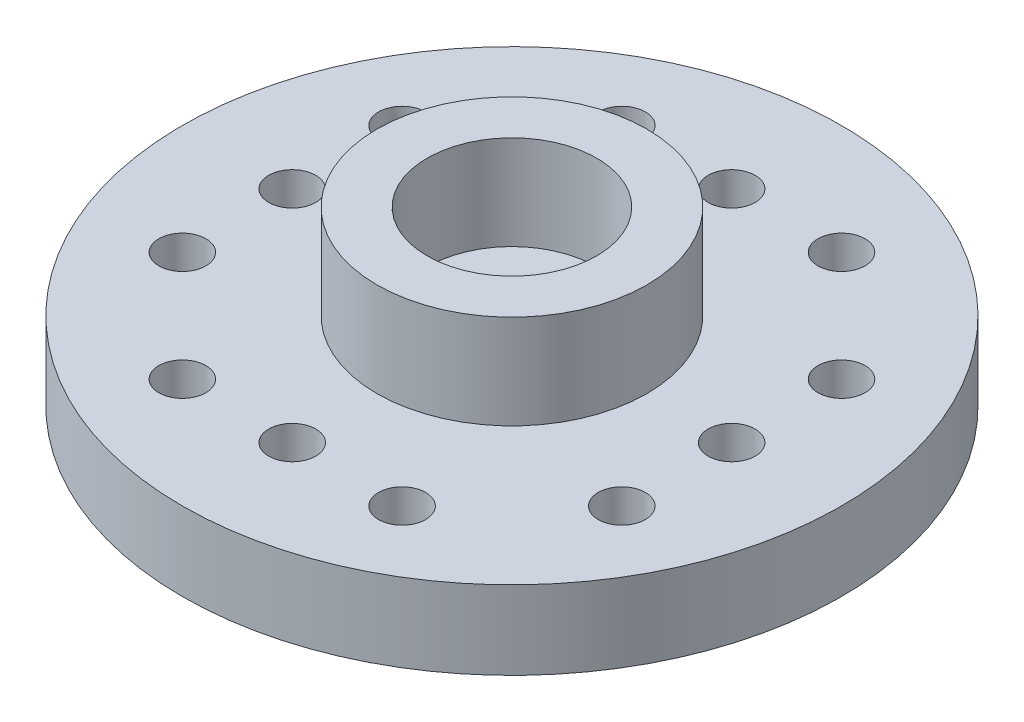
from build123d import *

# Parameters (mm, degrees)
SKETCH1_R           = 10.5
SKETCH1_R_2         = 1.5
BOSS_EXTRUDE1_DEPTH = 2.5
SKETCH2_R           = 4.3
SKETCH2_R_2         = 2.7
BOSS_EXTRUDE2_DEPTH = 3
SKETCH3_R           = 0.75
CUT_EXTRUDE1_DEPTH  = 16.149257408
CIRPATTERN1_COUNT   = 4
SKETCH4_R           = 4.3
SKETCH4_R_2         = 2.7
SKETCH4_R_3         = 2.2
SKETCH4_R_4         = 1.5
CUT_EXTRUDE2_DEPTH  = 1


with BuildPart() as part:
    # Sketch1 → Boss-Extrude1 (new body)
    with BuildSketch(Plane(origin=(0, 0, 0), x_dir=(1, 0, 0), z_dir=(0, 1, 0))):
        with Locations(Location((0, 0, 0), (0, 0, 270))):
            Circle(SKETCH1_R)
        with Locations(Location((0, 0, 0), (0, 0, 270))):
            Circle(SKETCH1_R_2, mode=Mode.SUBTRACT)
    extrude(amount=BOSS_EXTRUDE1_DEPTH)

    # Sketch2 → Boss-Extrude2 (add)
    with BuildSketch(Plane(origin=(0, 2.5, 0), x_dir=(1, 0, 0), z_dir=(0, 1, 0))):
        with Locations(Location((0, 0, 0), (0, 0, 270))):
            Circle(SKETCH2_R)
        with Locations(Location((0, 0, 0), (0, 0, 270))):
            Circle(SKETCH2_R_2, mode=Mode.SUBTRACT)
    extrude(amount=BOSS_EXTRUDE2_DEPTH)

    # Sketch3 → Cut-Extrude1 (cut, through all)
    with BuildSketch(Plane(origin=(0, 2.5, 0), x_dir=(1, 0, 0), z_dir=(0, 1, 0))):
        with Locations(Location((0, 7, 0), (0, 0, 270))):
            Circle(SKETCH3_R)
        with Locations(Location((3.5, 7, 0), (0, 0, 270))):
            Circle(SKETCH3_R)
        with Locations(Location((-3.5, 7, 0), (0, 0, 270))):
            Circle(SKETCH3_R)
    cut_extrude1 = extrude(amount=-CUT_EXTRUDE1_DEPTH, mode=Mode.SUBTRACT)

    # CirPattern1: Cut-Extrude1 ×4 about axis
    cirpattern1_axis = Axis((0, 0, 0), (0, 1, 0))
    for i in range(1, CIRPATTERN1_COUNT):
        add(cut_extrude1.rotate(cirpattern1_axis, i * 360 / CIRPATTERN1_COUNT), mode=Mode.SUBTRACT)

    # Sketch4 → Cut-Extrude2 (cut)
    # profile 1 of 2: a face of its own
    with BuildSketch(Plane.XZ):
        with Locations(Location((0, 0, 0), (0, 0, 90))):
            Circle(SKETCH4_R)
        with Locations(Location((0, 0, 0), (0, 0, 90))):
            Circle(SKETCH4_R_2, mode=Mode.SUBTRACT)
    # profile 2 of 2: a face of its own
    with BuildSketch(Plane.XZ):
        with Locations(Location((0, 0, 0), (0, 0, 270))):
            Circle(SKETCH4_R_3)
        with Locations(Location((0, 0, 0), (0, 0, 270))):
            Circle(SKETCH4_R_4, mode=Mode.SUBTRACT)
    extrude(amount=-CUT_EXTRUDE2_DEPTH, mode=Mode.SUBTRACT)


solid = part.part
